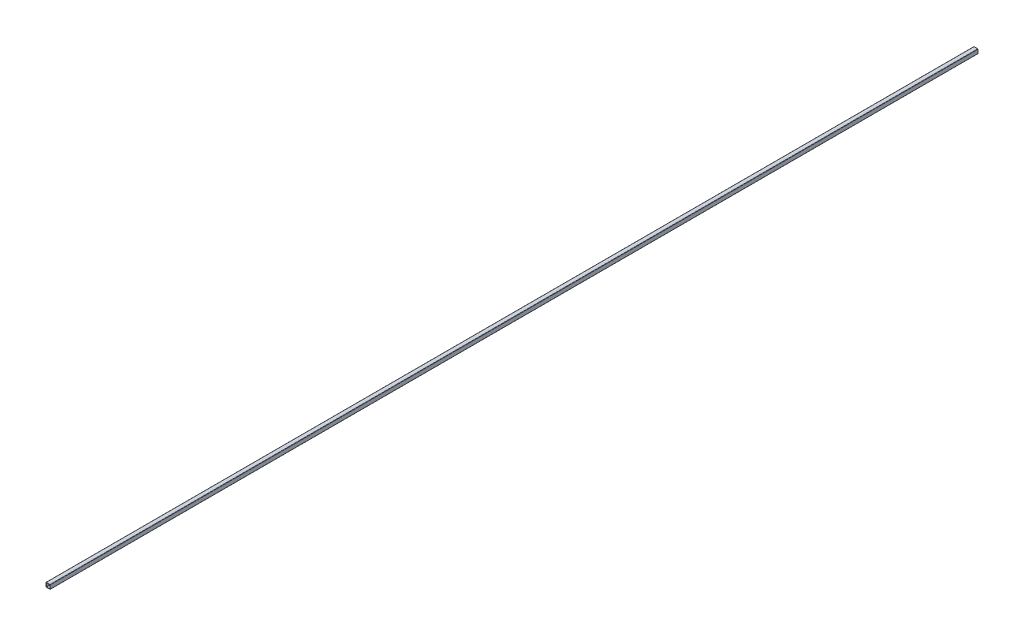
from build123d import *

# Parameters (mm, degrees)
BOSS_EXTRUDE1_DEPTH = 8380
FILLET1_R           = 1


with BuildPart() as part:
    # Sketch1 → Boss-Extrude1 (new body)
    with BuildSketch(Plane.XY):
        with BuildLine():
            Line((2.54, 0), (35.56, 0))
            ThreePointArc((35.56, 0), (37.356051224, -0.743948776), (38.1, -2.54))
            Line((38.1, -2.54), (38.1, -35.56))
            ThreePointArc((38.1, -35.56), (37.356051224, -37.356051224), (35.56, -38.1))
            Line((35.56, -38.1), (2.54, -38.1))
            ThreePointArc((2.54, -38.1), (0.743948776, -37.356051224), (0, -35.56))
            Line((0, -35.56), (0, -2.54))
            ThreePointArc((0, -2.54), (0.743948776, -0.743948776), (2.54, 0))
        make_face()
        with BuildLine():
            Line((5.3086, -2.7686), (32.7914, -2.7686))
            ThreePointArc((32.7914, -2.7686), (34.587451224, -3.512548776), (35.3314, -5.3086))
            Line((35.3314, -5.3086), (35.3314, -32.7914))
            ThreePointArc((35.3314, -32.7914), (34.587451224, -34.587451224), (32.7914, -35.3314))
            Line((32.7914, -35.3314), (5.3086, -35.3314))
            ThreePointArc((5.3086, -35.3314), (3.512548776, -34.587451224), (2.7686, -32.7914))
            Line((2.7686, -32.7914), (2.7686, -5.3086))
            ThreePointArc((2.7686, -5.3086), (3.512548776, -3.512548776), (5.3086, -2.7686))
        make_face(mode=Mode.SUBTRACT)
    extrude(amount=BOSS_EXTRUDE1_DEPTH)

    # Fillet1
    fillet1_edges = [part.edges().sort_by_distance(p)[0] for p in [
        (37.356051224, -37.356051224, 8380),
        (19.05, -38.1, 0),
        (0.743948776, -37.356051224, 0),
        (38.1, -19.05, 8380),
        (37.356051224, -0.743948776, 8380),
        (19.05, 0, 8380),
        (0.743948776, -0.743948776, 8380),
        (0, -19.05, 8380),
        (3.512548776, -34.587451224, 0),
        (19.05, -35.3314, 0),
        (34.587451224, -34.587451224, 0),
        (35.3314, -19.05, 0),
        (34.587451224, -3.512548776, 0),
        (19.05, -2.7686, 0),
        (3.512548776, -3.512548776, 0),
        (2.7686, -19.05, 0),
        (3.512548776, -34.587451224, 8380),
        (19.05, -35.3314, 8380),
        (34.587451224, -34.587451224, 8380),
        (35.3314, -19.05, 8380),
        (34.587451224, -3.512548776, 8380),
        (19.05, -2.7686, 8380),
        (3.512548776, -3.512548776, 8380),
        (2.7686, -19.05, 8380),
        (0.743948776, -37.356051224, 8380),
        (19.05, -38.1, 8380),
        (0, -19.05, 0),
        (0.743948776, -0.743948776, 0),
        (19.05, 0, 0),
        (37.356051224, -0.743948776, 0),
        (38.1, -19.05, 0),
        (37.356051224, -37.356051224, 0),
    ]]
    fillet(fillet1_edges, radius=FILLET1_R)


solid = part.part
